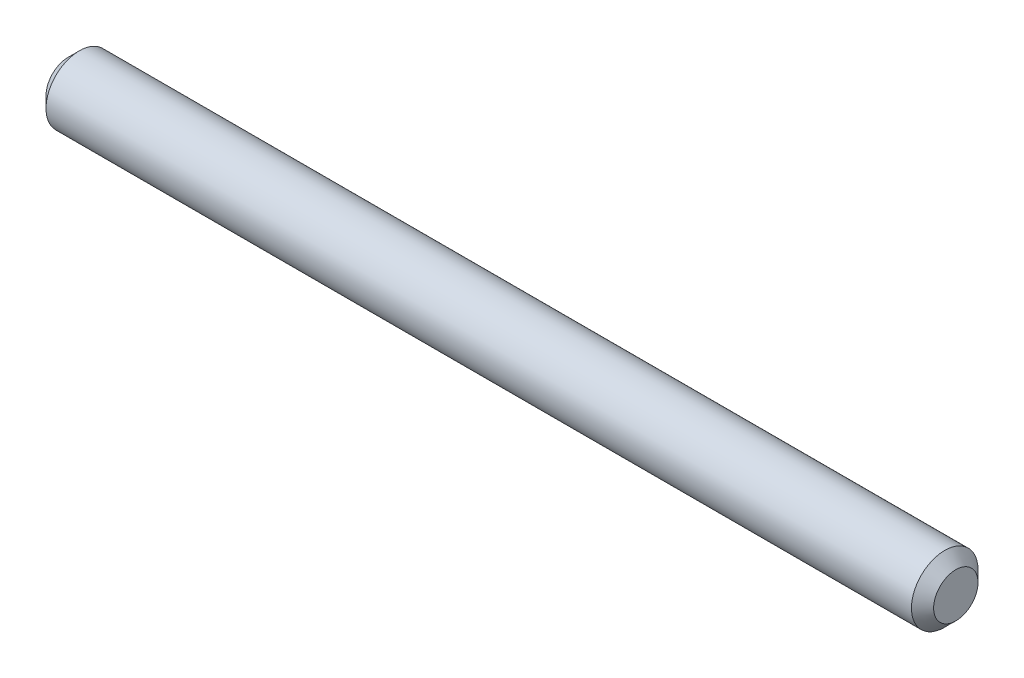
from build123d import *

# Parameters (mm, degrees)
SZKIC1_R                    = 3
DODANIE_WYCI_GNI_CIE1_DEPTH = 40
SFAZOWANIE1_SIZE            = 1


with BuildPart() as part:
    # Szkic1 → Dodanie-wyciągnięcie1 (new, symmetric)
    with BuildSketch(Plane(origin=(0, 0, 0), x_dir=(0, 0, -1), z_dir=(1, 0, 0))):
        Circle(SZKIC1_R)
    extrude(amount=DODANIE_WYCI_GNI_CIE1_DEPTH, both=True)

    # Sfazowanie1
    sfazowanie1_edges = [part.edges().sort_by_distance(p)[0] for p in [
        (-40, 0, 3),
        (40, 0, 3),
    ]]
    chamfer(sfazowanie1_edges, length=SFAZOWANIE1_SIZE)


solid = part.part
